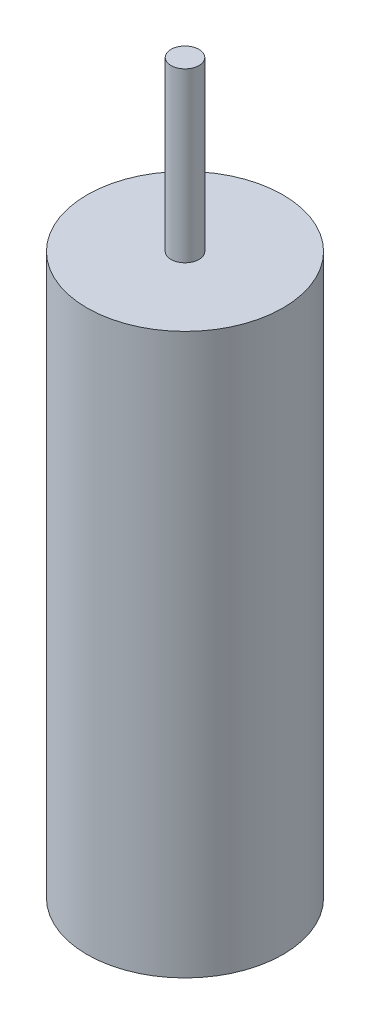
from build123d import *

# Parameters (mm, degrees)
SKETCH_1_R      = 3.5
EXTRUDE_1_DEPTH = 20
SKETCH_2_R      = 0.5
EXTRUDE_2_DEPTH = 6


with BuildPart() as part:
    # 草图1 → 凸台-拉伸1 (new body)
    with BuildSketch(Plane(origin=(0, 0, 0), x_dir=(1, 0, 0), z_dir=(0, 1, 0))):
        with Locations(Location((0, 0, 0), (0, 0, 270))):
            Circle(SKETCH_1_R)
    extrude(amount=EXTRUDE_1_DEPTH)

    # 草图2 → 凸台-拉伸2 (add)
    with BuildSketch(Plane(origin=(0, 20, 0), x_dir=(1, 0, 0), z_dir=(0, 1, 0))):
        with Locations(Location((0, 0, 0), (0, 0, 270))):
            Circle(SKETCH_2_R)
    extrude(amount=EXTRUDE_2_DEPTH)


solid = part.part
